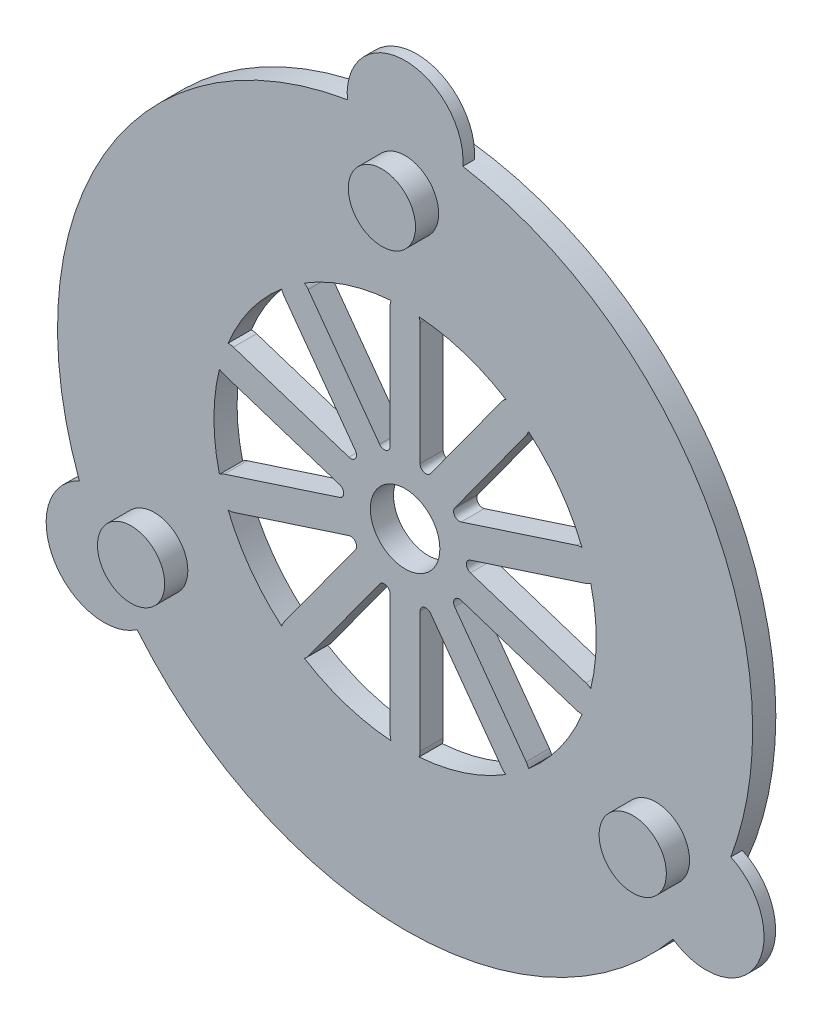
from build123d import *

# Parameters (mm, degrees)
BOSS_EXTRUDE1_DEPTH    = 2
BOSS_EXTRUDE1_2_DEPTH  = 2
BOSS_EXTRUDE1_3_DEPTH  = 2
BOSS_EXTRUDE1_4_DEPTH  = 2
BOSS_EXTRUDE1_5_DEPTH  = 2
BOSS_EXTRUDE1_6_DEPTH  = 2
BOSS_EXTRUDE1_7_DEPTH  = 2
BOSS_EXTRUDE1_8_DEPTH  = 2
BOSS_EXTRUDE1_9_DEPTH  = 2
BOSS_EXTRUDE1_10_DEPTH = 2
SKETCH3_R              = 30
SKETCH3_R_2            = 16.5
BOSS_EXTRUDE2_DEPTH    = 2
SKETCH4_R              = 2.9
BOSS_EXTRUDE3_DEPTH    = 2
SKETCH6_R              = 5
BOSS_EXTRUDE4_DEPTH    = 1
SKETCH13_R             = 4.177329345
BOSS_EXTRUDE6_DEPTH    = 2
FILLET2_R              = 0.5
SKETCH14_R             = 3
CUT_EXTRUDE1_DEPTH     = 20


with BuildPart() as part:
    # Sketch2 → Boss-Extrude1 (new body)
    with BuildSketch(Plane.XY.offset(10)):
        with BuildLine():
            Line((8.357492916, 13.704694326), (1.290071734, 3.973134201))
            Line((1.290071734, 3.973134201), (1.290510646, 1.776982243))
            Line((1.290510646, 1.776982243), (3.379039645, 2.45604795))
            Line((3.379039645, 2.45604795), (10.446460828, 12.187608075))
            ThreePointArc((10.446460828, 12.187608075), (10.160519997, 13.990635156), (8.357492916, 13.704694326))
        make_face()
    extrude(amount=BOSS_EXTRUDE1_DEPTH)


with BuildPart() as body_2:
    # Sketch2 → Boss-Extrude1 2 (new body)
    with BuildSketch(Plane.XY.offset(10)):
        with BuildLine():
            Line((1.290071734, 3.973134201), (1.287668054, 16.000257666))
            ThreePointArc((1.287668054, 16.000257666), (-0.003455665, 17.290865413), (-1.294063412, 15.999741695))
            Line((-1.294063412, 15.999741695), (-1.291659732, 3.972618229))
            Line((-1.291659732, 3.972618229), (-0.000438912, 2.196151958))
            Line((-0.000438912, 2.196151958), (1.290071734, 3.973134201))
        make_face()
    extrude(amount=BOSS_EXTRUDE1_2_DEPTH)


with BuildPart() as body_3:
    # Sketch2 → Boss-Extrude1 3 (new body)
    with BuildSketch(Plane.XY.offset(10)):
        with BuildLine():
            Line((-1.29122082, 1.776466271), (-1.291659732, 3.972618229))
            Line((-1.291659732, 3.972618229), (-8.362970151, 13.701352658))
            ThreePointArc((-8.362970151, 13.701352658), (-10.166111381, 13.986572778), (-10.451331501, 12.183431547))
            Line((-10.451331501, 12.183431547), (-3.380021082, 2.454697118))
            Line((-3.380021082, 2.454697118), (-1.29122082, 1.776466271))
        make_face()
    extrude(amount=BOSS_EXTRUDE1_3_DEPTH)


with BuildPart() as body_4:
    # Sketch2 → Boss-Extrude1 4 (new body)
    with BuildSketch(Plane.XY.offset(10)):
        with BuildLine():
            Line((-2.088800262, 0.678230847), (-3.380021082, 2.454697118))
            Line((-3.380021082, 2.454697118), (-14.819238004, 6.168996626))
            ThreePointArc((-14.819238004, 6.168996626), (-16.445658083, 5.339884727), (-15.616546184, 3.713464648))
            Line((-15.616546184, 3.713464648), (-4.177329262, -0.00083486))
            Line((-4.177329262, -0.00083486), (-2.088800262, 0.678230847))
        make_face()
    extrude(amount=BOSS_EXTRUDE1_4_DEPTH)


with BuildPart() as body_5:
    # Sketch2 → Boss-Extrude1 5 (new body)
    with BuildSketch(Plane.XY.offset(10)):
        with BuildLine():
            Line((-2.088529, -0.679065707), (-4.177329262, -0.00083486))
            Line((-4.177329262, -0.00083486), (-15.615060628, -3.71970644))
            ThreePointArc((-15.615060628, -3.71970644), (-16.443522365, -5.346457793), (-14.816771011, -6.17491953))
            Line((-14.816771011, -6.17491953), (-3.379039645, -2.45604795))
            Line((-3.379039645, -2.45604795), (-2.088529, -0.679065707))
        make_face()
    extrude(amount=BOSS_EXTRUDE1_5_DEPTH)


with BuildPart() as body_6:
    # Sketch2 → Boss-Extrude1 6 (new body)
    with BuildSketch(Plane.XY.offset(10)):
        with BuildLine():
            Line((-1.290510646, -1.776982243), (-3.379039645, -2.45604795))
            Line((-3.379039645, -2.45604795), (-10.446460828, -12.187608075))
            ThreePointArc((-10.446460828, -12.187608075), (-10.160519997, -13.990635156), (-8.357492916, -13.704694326))
            Line((-8.357492916, -13.704694326), (-1.290071734, -3.973134201))
            Line((-1.290071734, -3.973134201), (-1.290510646, -1.776982243))
        make_face()
    extrude(amount=BOSS_EXTRUDE1_6_DEPTH)


with BuildPart() as body_7:
    # Sketch2 → Boss-Extrude1 7 (new body)
    with BuildSketch(Plane.XY.offset(10)):
        with BuildLine():
            Line((1.294063412, -15.999741695), (1.291659732, -3.972618229))
            Line((1.291659732, -3.972618229), (0.000438912, -2.196151958))
            Line((0.000438912, -2.196151958), (-1.290071734, -3.973134201))
            Line((-1.290071734, -3.973134201), (-1.287668054, -16.000257666))
            ThreePointArc((-1.287668054, -16.000257666), (0.003455665, -17.290865413), (1.294063412, -15.999741695))
        make_face()
    extrude(amount=BOSS_EXTRUDE1_7_DEPTH)


with BuildPart() as body_8:
    # Sketch2 → Boss-Extrude1 8 (new body)
    with BuildSketch(Plane.XY.offset(10)):
        with BuildLine():
            Line((10.451331501, -12.183431547), (3.380021082, -2.454697118))
            Line((3.380021082, -2.454697118), (1.29122082, -1.776466271))
            Line((1.29122082, -1.776466271), (1.291659732, -3.972618229))
            Line((1.291659732, -3.972618229), (8.362970151, -13.701352658))
            ThreePointArc((8.362970151, -13.701352658), (10.166111381, -13.986572778), (10.451331501, -12.183431547))
        make_face()
    extrude(amount=BOSS_EXTRUDE1_8_DEPTH)


with BuildPart() as body_9:
    # Sketch2 → Boss-Extrude1 9 (new body)
    with BuildSketch(Plane.XY.offset(10)):
        with BuildLine():
            Line((15.616546184, -3.713464648), (4.177329262, 0.00083486))
            Line((4.177329262, 0.00083486), (2.088800262, -0.678230847))
            Line((2.088800262, -0.678230847), (3.380021082, -2.454697118))
            Line((3.380021082, -2.454697118), (14.819238004, -6.168996626))
            ThreePointArc((14.819238004, -6.168996626), (16.445658083, -5.339884727), (15.616546184, -3.713464648))
        make_face()
    extrude(amount=BOSS_EXTRUDE1_9_DEPTH)


with BuildPart() as body_10:
    # Sketch2 → Boss-Extrude1 10 (new body)
    with BuildSketch(Plane.XY.offset(10)):
        with BuildLine():
            Line((14.816771011, 6.17491953), (3.379039645, 2.45604795))
            Line((3.379039645, 2.45604795), (2.088529, 0.679065707))
            Line((2.088529, 0.679065707), (4.177329262, 0.00083486))
            Line((4.177329262, 0.00083486), (15.615060628, 3.71970644))
            ThreePointArc((15.615060628, 3.71970644), (16.443522365, 5.346457793), (14.816771011, 6.17491953))
        make_face()
    extrude(amount=BOSS_EXTRUDE1_10_DEPTH)


with BuildPart() as body_11:
    # Sketch3 → Boss-Extrude2 (new body)
    with BuildSketch(Plane.XY.offset(12)):
        Circle(SKETCH3_R)
        Circle(SKETCH3_R_2, mode=Mode.SUBTRACT)
    extrude(amount=-BOSS_EXTRUDE2_DEPTH)

    # Sketch4 → Boss-Extrude3 (add)
    with BuildSketch(Plane.XY.offset(12)):
        with Locations((0, 25)):
            Circle(SKETCH4_R)
        with Locations((21.650635095, -12.5)):
            Circle(SKETCH4_R)
        with Locations((-21.650635095, -12.5)):
            Circle(SKETCH4_R)
    extrude(amount=BOSS_EXTRUDE3_DEPTH)

    # Sketch6 → Boss-Extrude4 (add)
    with BuildSketch(Plane(origin=(0, 0, 11), x_dir=(-1, 0, 0), z_dir=(0, 0, -1))):
        with Locations((0, 30)):
            Circle(SKETCH6_R)
        with Locations((25.980762114, -15)):
            Circle(SKETCH6_R)
        with Locations((-25.980762114, -15)):
            Circle(SKETCH6_R)
    extrude(amount=-BOSS_EXTRUDE4_DEPTH)


    add(part.part)  # Boss-Extrude6 merges part

    add(body_3.part)  # Boss-Extrude6 merges body 3

    add(body_5.part)  # Boss-Extrude6 merges body 5

    add(body_7.part)  # Boss-Extrude6 merges body 7

    add(body_9.part)  # Boss-Extrude6 merges body 9

    add(body_2.part)  # Boss-Extrude6 merges body 2

    add(body_4.part)  # Boss-Extrude6 merges body 4

    add(body_6.part)  # Boss-Extrude6 merges body 6

    add(body_8.part)  # Boss-Extrude6 merges body 8

    add(body_10.part)  # Boss-Extrude6 merges body 10
    # Sketch13 → Boss-Extrude6 (add)
    with BuildSketch(Plane(origin=(0, 0, 10), x_dir=(-1, 0, 0), z_dir=(0, 0, -1))):
        Circle(SKETCH13_R)
    extrude(amount=-BOSS_EXTRUDE6_DEPTH)

    # Fillet2
    fillet2_edges = [body_11.edges().sort_by_distance(p)[0] for p in [
        (-1.290071734, -3.973134201, 11),
        (1.291659732, -3.972618229, 11),
        (3.380021082, -2.454697118, 11),
        (4.177329262, 0.00083486, 11),
        (3.379039645, 2.45604795, 11),
        (1.290071734, 3.973134201, 11),
        (-1.291659732, 3.972618229, 11),
        (-3.380021082, 2.454697118, 11),
        (-4.177329262, -0.00083486, 11),
        (-3.379039645, -2.45604795, 11),
    ]]
    fillet(fillet2_edges, radius=FILLET2_R)

    # Sketch14 → Cut-Extrude1 (cut)
    with BuildSketch(Plane(origin=(0, 0, 10), x_dir=(-1, 0, 0), z_dir=(0, 0, -1))):
        Circle(SKETCH14_R)
    extrude(amount=-CUT_EXTRUDE1_DEPTH, mode=Mode.SUBTRACT)


solid = body_11.part
